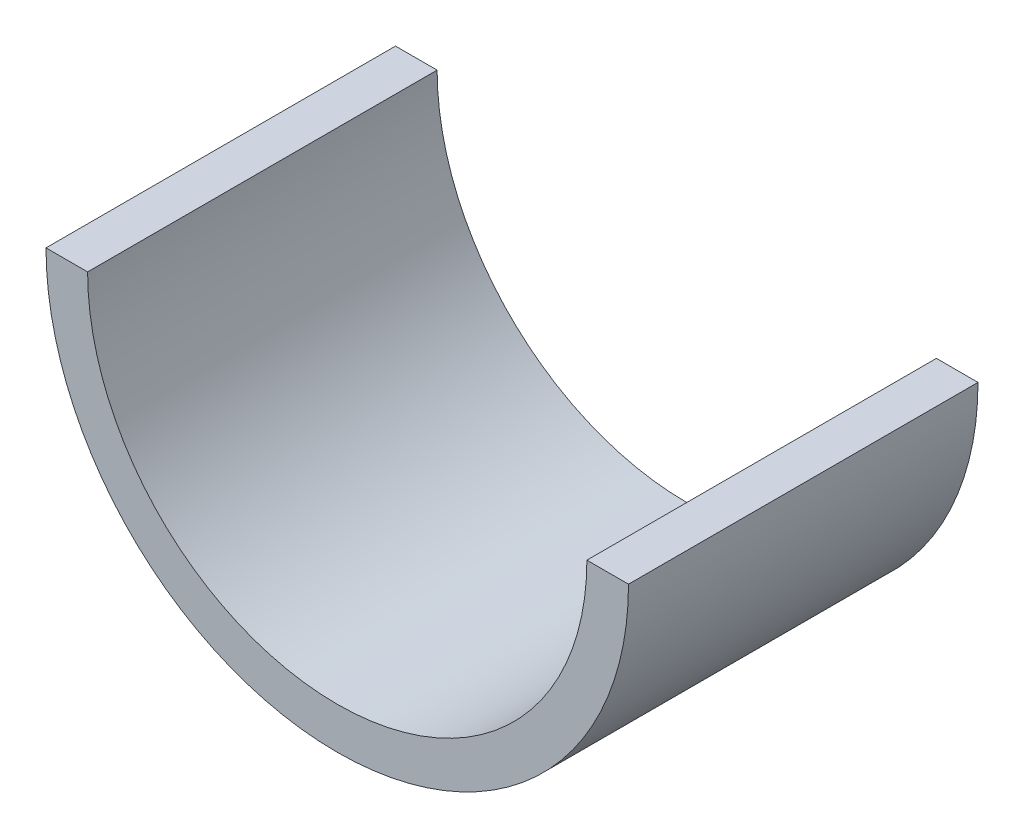
from build123d import *

# Parameters (mm, degrees)
EXTRUDE_1_DEPTH = 42


with BuildPart() as part:
    # Эскиз1 → Бобышка-Вытянуть1 (new body)
    with BuildSketch(Plane.XY):
        with BuildLine():
            Line((-30, 0), (-35, 0))
            ThreePointArc((-35, 0), (0, -35), (35, 0))
            Line((35, 0), (30, 0))
            ThreePointArc((30, 0), (0, -30), (-30, 0))
        make_face()
    extrude(amount=EXTRUDE_1_DEPTH)


solid = part.part
